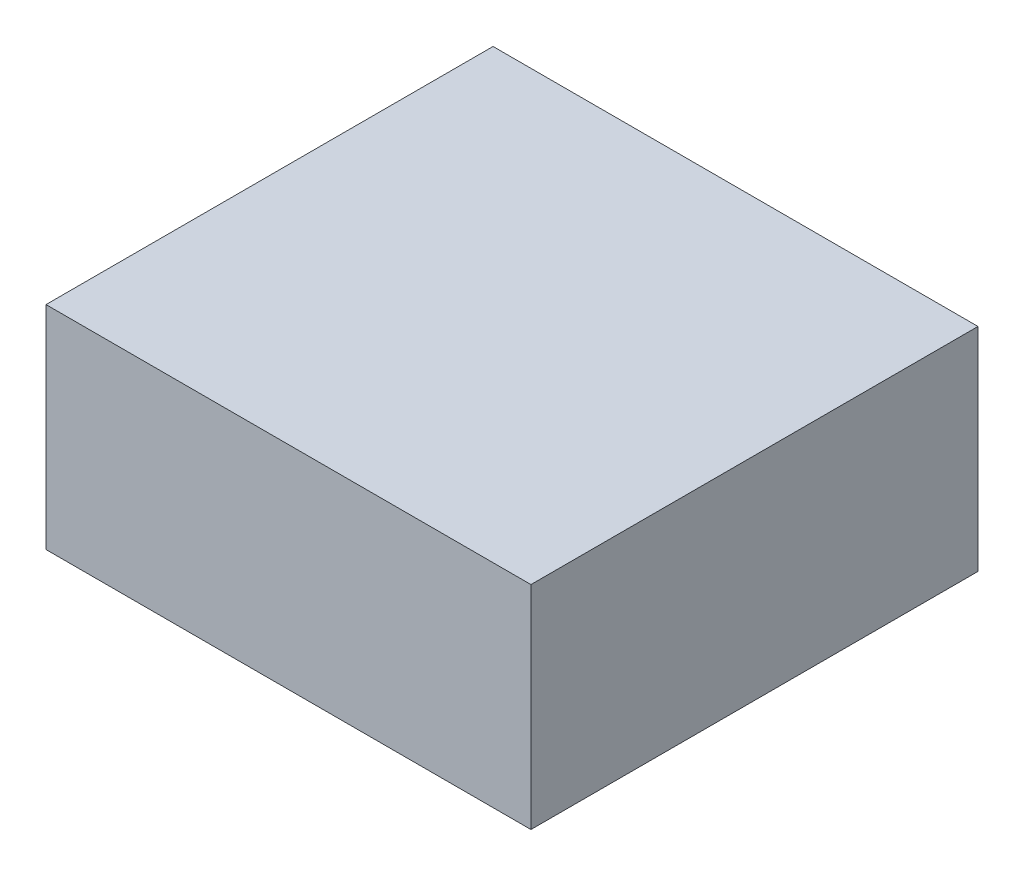
from build123d import *

# Parameters (mm, degrees)
SKETCH1_W           = 64
SKETCH1_H           = 59
BOSS_EXTRUDE1_DEPTH = 28


with BuildPart() as part:
    # Sketch1 → Boss-Extrude1 (new body)
    with BuildSketch(Plane(origin=(0, 0, 0), x_dir=(1, 0, 0), z_dir=(0, 1, 0))):
        with Locations((32, 29.5)):
            Rectangle(SKETCH1_W, SKETCH1_H)
    extrude(amount=BOSS_EXTRUDE1_DEPTH)


solid = part.part
